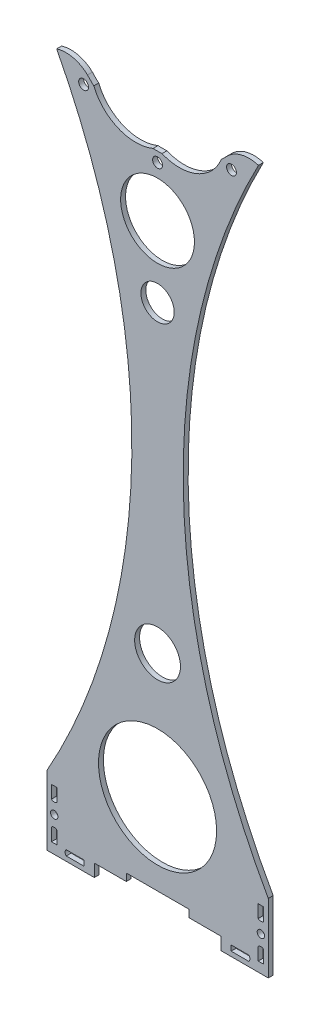
from build123d import *

# Parameters (mm, degrees)
SKETCH_3_R      = 2
SKETCH_3_R_2    = 1.5
SKETCH_3_R_3    = 24
SKETCH_3_R_4    = 15
SKETCH_3_R_5    = 9.300530536
SKETCH_3_R_6    = 6.764022208
EXTRUDE_1_DEPTH = 2


with BuildPart() as part:
    # 草图3 → 凸台-拉伸1 (new body)
    with BuildSketch(Plane.XY):
        with BuildLine():
            Line((-45.000000203, -253.990216873), (-45.000000203, -225.990216873))
            ThreePointArc((-45.000000203, -225.990216873), (-10.464636425, -98.498581931), (-41.000000203, 30.00978313))
            ThreePointArc((-41.000000203, 30.00978313), (-34.337300158, 30.272772604), (-28.47422393, 27.097072286))
            ThreePointArc((-28.47422393, 27.097072286), (-27.224139288, 25.786699845), (-25.913815771, 24.536563921))
            ThreePointArc((-25.913815771, 24.536563921), (-15.930569702, 14.552804479), (-1.811764705, 14.5524367))
            ThreePointArc((-1.811764705, 14.5524367), (-0.001002499, 14.509783327), (1.809761926, 14.552342399))
            ThreePointArc((1.809761926, 14.552342399), (15.928572681, 14.55197476), (25.912339468, 24.535221628))
            ThreePointArc((25.912339468, 24.535221628), (27.223433456, 25.78599462), (28.474223558, 27.097072286))
            ThreePointArc((28.474223558, 27.097072286), (34.337299786, 30.272772604), (40.999999832, 30.00978313))
            ThreePointArc((40.999999832, 30.00978313), (10.464636053, -98.498581931), (44.999999832, -225.990216873))
            Line((44.999999832, -225.990216873), (44.999999832, -253.990216873))
            Line((44.999999832, -253.990216873), (40.999999832, -253.990216873))
            Line((40.999999832, -253.990216873), (25.699999832, -253.990216873))
            Line((25.699999832, -253.990216873), (25.699999832, -249.890216873))
            Line((25.699999832, -249.890216873), (25.699999832, -248.890216873))
            Line((25.699999832, -248.890216873), (12.699999797, -248.890216873))
            Line((12.699999797, -248.890216873), (12.699999797, -245.890216873))
            Line((12.699999797, -245.890216873), (-12.700000168, -245.890216873))
            Line((-12.700000168, -245.890216873), (-12.700000168, -248.890216873))
            Line((-12.700000168, -248.890216873), (-25.700000203, -248.890216873))
            Line((-25.700000203, -248.890216873), (-25.700000203, -249.890216873))
            Line((-25.700000203, -249.890216873), (-25.700000203, -253.990216873))
            Line((-25.700000203, -253.990216873), (-41.000000203, -253.990216873))
            Line((-41.000000203, -253.990216873), (-42, -253.990216873))
            Line((-42, -253.990216873), (-44.000000203, -253.990216873))
            Line((-44.000000203, -253.990216873), (-45.000000203, -253.990216873))
        make_face()
        with Locations((0, 10.509783315)):
            Circle(SKETCH_3_R, mode=Mode.SUBTRACT)
        with Locations((-30.0520382, 22.957745114)):
            Circle(SKETCH_3_R, mode=Mode.SUBTRACT)
        with Locations((30.0520382, 22.957745114)):
            Circle(SKETCH_3_R, mode=Mode.SUBTRACT)
        with Locations((41.999999628, -239.990216688)):
            Circle(SKETCH_3_R_2, mode=Mode.SUBTRACT)
        with Locations(Location((-42, -239.990216688, 0), (0, 0, 180))):
            Circle(SKETCH_3_R_2, mode=Mode.SUBTRACT)
        with Locations((0, -212.7618397)):
            Circle(SKETCH_3_R_3, mode=Mode.SUBTRACT)
        with Locations((0, -9.975031617)):
            Circle(SKETCH_3_R_4, mode=Mode.SUBTRACT)
        with Locations((0, -162.250886598)):
            Circle(SKETCH_3_R_5, mode=Mode.SUBTRACT)
        with Locations((0, -38.807481302)):
            Circle(SKETCH_3_R_6, mode=Mode.SUBTRACT)
        with BuildLine():
            Line((-37.1, -252.090216688), (-29.9, -252.090216688))
            Line((-29.9, -252.090216688), (-29.9, -249.890216688))
            Line((-29.9, -249.890216688), (-37.1, -249.890216688))
            ThreePointArc((-37.1, -249.890216688), (-37.555634919, -250.990216688), (-37.1, -252.090216688))
        make_face(mode=Mode.SUBTRACT)
        with BuildLine():
            Line((29.9, -252.090216688), (29.9, -249.890216688))
            Line((29.9, -249.890216688), (37.1, -249.890216688))
            ThreePointArc((37.1, -249.890216688), (37.555634919, -250.990216688), (37.1, -252.090216688))
            Line((37.1, -252.090216688), (29.9, -252.090216688))
        make_face(mode=Mode.SUBTRACT)
        with BuildLine():
            Line((-43.1, -244.890216688), (-43.1, -250.090216688))
            Line((-43.1, -250.090216688), (-40.9, -250.090216688))
            Line((-40.9, -250.090216688), (-40.9, -244.890216688))
            ThreePointArc((-40.9, -244.890216688), (-42, -244.434581769), (-43.1, -244.890216688))
        make_face(mode=Mode.SUBTRACT)
        with BuildLine():
            Line((-43.1, -229.890216688), (-43.1, -235.090216688))
            ThreePointArc((-43.1, -235.090216688), (-42, -235.545851606), (-40.9, -235.090216688))
            Line((-40.9, -235.090216688), (-40.9, -229.890216688))
            Line((-40.9, -229.890216688), (-43.1, -229.890216688))
        make_face(mode=Mode.SUBTRACT)
        with BuildLine():
            Line((40.899999628, -229.890216688), (40.899999628, -235.090216688))
            ThreePointArc((40.899999628, -235.090216688), (41.999999628, -235.545851606), (43.099999628, -235.090216688))
            Line((43.099999628, -235.090216688), (43.099999628, -229.890216688))
            Line((43.099999628, -229.890216688), (40.899999628, -229.890216688))
        make_face(mode=Mode.SUBTRACT)
        with BuildLine():
            Line((40.899999628, -244.890216688), (40.899999628, -250.090216688))
            Line((40.899999628, -250.090216688), (43.099999628, -250.090216688))
            Line((43.099999628, -250.090216688), (43.099999628, -244.890216688))
            ThreePointArc((43.099999628, -244.890216688), (41.999999628, -244.434581769), (40.899999628, -244.890216688))
        make_face(mode=Mode.SUBTRACT)
    extrude(amount=EXTRUDE_1_DEPTH)


solid = part.part
